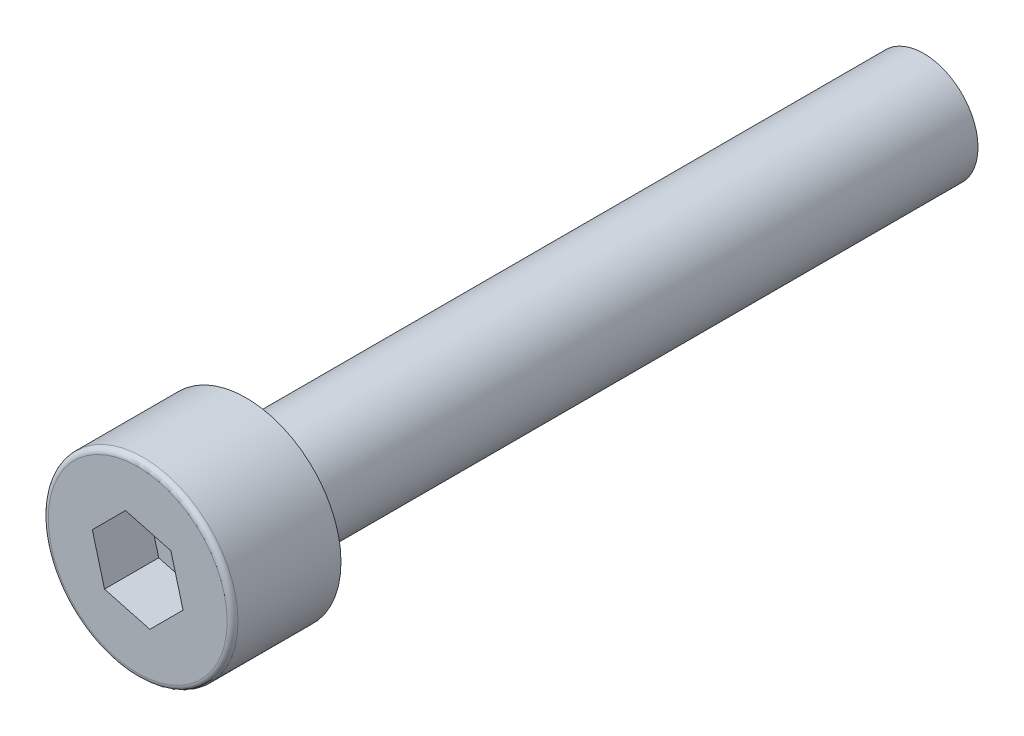
from build123d import *

# Parameters (mm, degrees)
SKETCH_1_R          = 3.5
EXTRUDE_1_DEPTH     = 4
CUT_EXTRUDE_1_DEPTH = 2
SKETCH_3_R          = 2
EXTRUDE_2_DEPTH     = 25
FILLET_1_R          = 0.2


with BuildPart() as part:
    # 草图1 → 凸台-拉伸1 (new body)
    with BuildSketch(Plane.XY):
        Circle(SKETCH_1_R)
    extrude(amount=EXTRUDE_1_DEPTH)

    # 草图2 → 切除-拉伸1 (cut)
    with BuildSketch(Plane.XY.offset(4)):
        Polygon((-1.224744871, -1.224744871), (0.448287736, -1.673032607), (1.673032607, -0.448287736), (1.224744871, 1.224744871), (-0.448287736, 1.673032607), (-1.673032607, 0.448287736), align=None)
    extrude(amount=-CUT_EXTRUDE_1_DEPTH, mode=Mode.SUBTRACT)

    # 草图3 → 凸台-拉伸2 (add)
    with BuildSketch(Plane(origin=(0, 0, 0), x_dir=(-1, 0, 0), z_dir=(0, 0, -1))):
        with Locations(Location((0, 0, 0), (0, 0, 180))):
            Circle(SKETCH_3_R)
    extrude(amount=EXTRUDE_2_DEPTH)

    # 圆角1
    fillet_1_edges = [part.edges().sort_by_distance(p)[0] for p in [
        (-3.5, 0, 4),
    ]]
    fillet(fillet_1_edges, radius=FILLET_1_R)


solid = part.part
